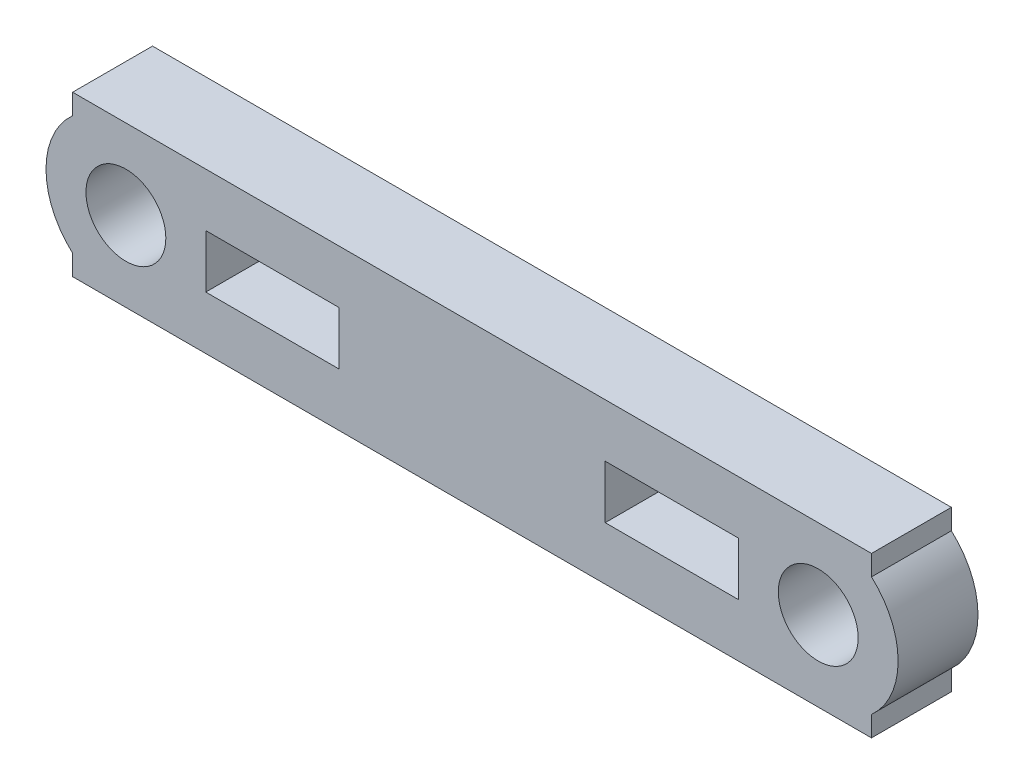
from build123d import *

# Parameters (mm, degrees)
SKETCH1_W           = 30
SKETCH1_H           = 6
SKETCH1_R           = 1.5
BOSS_EXTRUDE1_DEPTH = 3
BOSS_EXTRUDE3_DEPTH = 3


with BuildPart() as part:
    # Sketch1 → Boss-Extrude1 (new body)
    with BuildSketch(Plane.XY):
        with Locations((-68.559747397, 26.091138903)):
            Rectangle(SKETCH1_W, SKETCH1_H)
        with Locations((-81.559747397, 26.091138903)):
            Circle(SKETCH1_R, mode=Mode.SUBTRACT)
        with Locations((-55.559747397, 26.091138903)):
            Circle(SKETCH1_R, mode=Mode.SUBTRACT)
        Polygon((-78.559747397, 26.091138903), (-78.559747397, 27.091138903), (-73.559747397, 27.091138903), (-73.559747397, 25.091138903), (-78.559747397, 25.091138903), align=None, mode=Mode.SUBTRACT)
        Polygon((-58.559747397, 26.091138903), (-58.559747397, 25.091138903), (-63.559747397, 25.091138903), (-63.559747397, 27.091138903), (-58.559747397, 27.091138903), align=None, mode=Mode.SUBTRACT)
    extrude(amount=BOSS_EXTRUDE1_DEPTH)

    # Sketch3 → Boss-Extrude3 (add)
    with BuildSketch(Plane.XY.offset(3)):
        with BuildLine():
            Line((-83.559747397, 26.091138903), (-83.559747397, 28.32720688))
            ThreePointArc((-83.559747397, 28.32720688), (-84.559747397, 26.091138903), (-83.559747397, 23.855070925))
            Line((-83.559747397, 23.855070925), (-83.559747397, 26.091138903))
        make_face()
        with BuildLine():
            Line((-53.559747397, 26.091138903), (-53.559747397, 28.32720688))
            ThreePointArc((-53.559747397, 28.32720688), (-52.559747397, 26.091138903), (-53.559747397, 23.855070925))
            Line((-53.559747397, 23.855070925), (-53.559747397, 26.091138903))
        make_face()
    extrude(amount=-BOSS_EXTRUDE3_DEPTH)


solid = part.part
